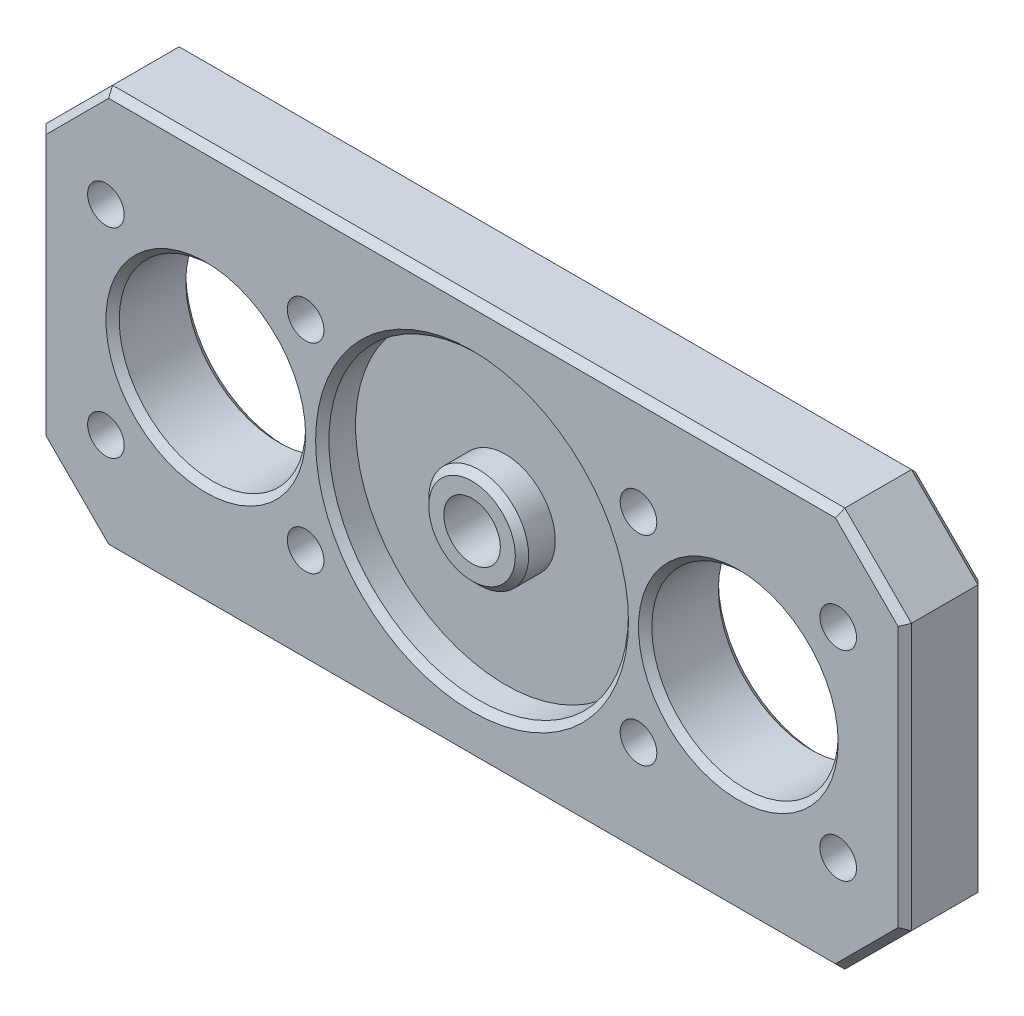
from build123d import *

# Parameters (mm, degrees)
SKETCH_1_W                = 130
SKETCH_1_H                = 60
EXTRUDE_1_DEPTH           = 12
SKETCH_4_R                = 16.5
EXTRUDE_2_DEPTH           = 6
HOLE_WIZARD_M10_1_D       = 8.5
HOLE_WIZARD_M10_1_DEPTH   = 24.5
HOLE_WIZARD_M10_1_TIP     = 2.553657631
HOLE_WIZARD_1_D           = 5.5
HOLE_WIZARD_1_DEPTH       = 15
HOLE_WIZARD_1_CBORE_D     = 10
HOLE_WIZARD_1_CBORE_DEPTH = 5.7
HOLE_WIZARD_1_TIP         = 1.652366702
CHAMFER_1_SIZE            = 10
CHAMFER_2_SIZE            = 1
SKETCH_7_R                = 14
CUT_EXTRUDE_1_DEPTH       = 73.587877776
CHAMFER_3_SIZE            = 1
SKETCH_8_R                = 22.5
SKETCH_8_R_2              = 7.5
CUT_EXTRUDE_2_DEPTH       = 5
CHAMFER_4_SIZE            = 1


with BuildPart() as part:
    # 草图1 → 凸台-拉伸1 (new body)
    with BuildSketch(Plane.XY):
        Rectangle(SKETCH_1_W, SKETCH_1_H)
    extrude(amount=EXTRUDE_1_DEPTH)

    # 草图4 → 凸台-拉伸2 (add)
    with BuildSketch(Plane(origin=(0, 0, 0), x_dir=(-1, 0, 0), z_dir=(0, 0, -1))):
        Circle(SKETCH_4_R)
    extrude(amount=EXTRUDE_2_DEPTH)

    # M10 螺纹孔1
    with Locations(Plane(origin=(0, 0, -6), x_dir=(-1, 0, 0), z_dir=(0, 0, -1))):
        with Locations((0, 0)):
            Hole(HOLE_WIZARD_M10_1_D / 2, depth=HOLE_WIZARD_M10_1_DEPTH)
            with Locations((0, 0, -(HOLE_WIZARD_M10_1_DEPTH + HOLE_WIZARD_M10_1_TIP / 2))):  # 118° drill point
                Cone(0, HOLE_WIZARD_M10_1_D / 2, HOLE_WIZARD_M10_1_TIP, mode=Mode.SUBTRACT)

    # 打孔尺寸(%根据)内六角圆柱头螺钉的类型1
    with Locations(Plane(origin=(0, 0, 0), x_dir=(-1, 0, 0), z_dir=(0, 0, -1))):
        with Locations((-55, 15), (-55, -15), (-25, 15), (-25, -15), (55, -15), (25, 15), (25, -15), (55, 15)):
            CounterBoreHole(HOLE_WIZARD_1_D / 2, HOLE_WIZARD_1_CBORE_D / 2, HOLE_WIZARD_1_CBORE_DEPTH, depth=HOLE_WIZARD_1_DEPTH)
            with Locations((0, 0, -(HOLE_WIZARD_1_DEPTH + HOLE_WIZARD_1_TIP / 2))):  # 118° drill point
                Cone(0, HOLE_WIZARD_1_D / 2, HOLE_WIZARD_1_TIP, mode=Mode.SUBTRACT)

    # 倒角1
    chamfer_1_edges = [part.edges().sort_by_distance(p)[0] for p in [
        (65, -30, 6),
        (-65, -30, 6),
        (-65, 30, 6),
        (65, 30, 6),
    ]]
    chamfer(chamfer_1_edges, length=CHAMFER_1_SIZE)

    # 倒角2
    chamfer_2_edges = [part.edges().sort_by_distance(p)[0] for p in [
        (0, -30, 0),
        (0, -30, 12),
        (65, 0, 0),
        (-65, 0, 0),
        (0, 30, 0),
        (60, 25, 0),
        (60, -25, 0),
        (-60, 25, 0),
        (-60, -25, 0),
        (-65, 0, 12),
        (65, 0, 12),
        (0, 30, 12),
        (60, 25, 12),
        (60, -25, 12),
        (-60, 25, 12),
        (-60, -25, 12),
    ]]
    chamfer(chamfer_2_edges, length=CHAMFER_2_SIZE)

    # 草图7 → 切除-拉伸1 (cut, through all)
    with BuildSketch(Plane(origin=(0, 0, 0), x_dir=(-1, 0, 0), z_dir=(0, 0, -1))):
        with Locations((-40, 0)):
            Circle(SKETCH_7_R)
        with Locations((40, 0)):
            Circle(SKETCH_7_R)
    extrude(amount=-CUT_EXTRUDE_1_DEPTH, mode=Mode.SUBTRACT)

    # 倒角3
    chamfer_3_edges = [part.edges().sort_by_distance(p)[0] for p in [
        (54, 0, 12),
        (54, 0, 0),
        (-26, 0, 12),
        (-26, 0, 0),
    ]]
    chamfer(chamfer_3_edges, length=CHAMFER_3_SIZE)

    # 草图8 → 切除-拉伸2 (cut)
    with BuildSketch(Plane.XY.offset(12)):
        Circle(SKETCH_8_R)
        Circle(SKETCH_8_R_2, mode=Mode.SUBTRACT)
    extrude(amount=-CUT_EXTRUDE_2_DEPTH, mode=Mode.SUBTRACT)

    # 倒角4
    chamfer_4_edges = [part.edges().sort_by_distance(p)[0] for p in [
        (-22.5, 0, 12),
        (-7.5, 0, 12),
    ]]
    chamfer(chamfer_4_edges, length=CHAMFER_4_SIZE)


solid = part.part
